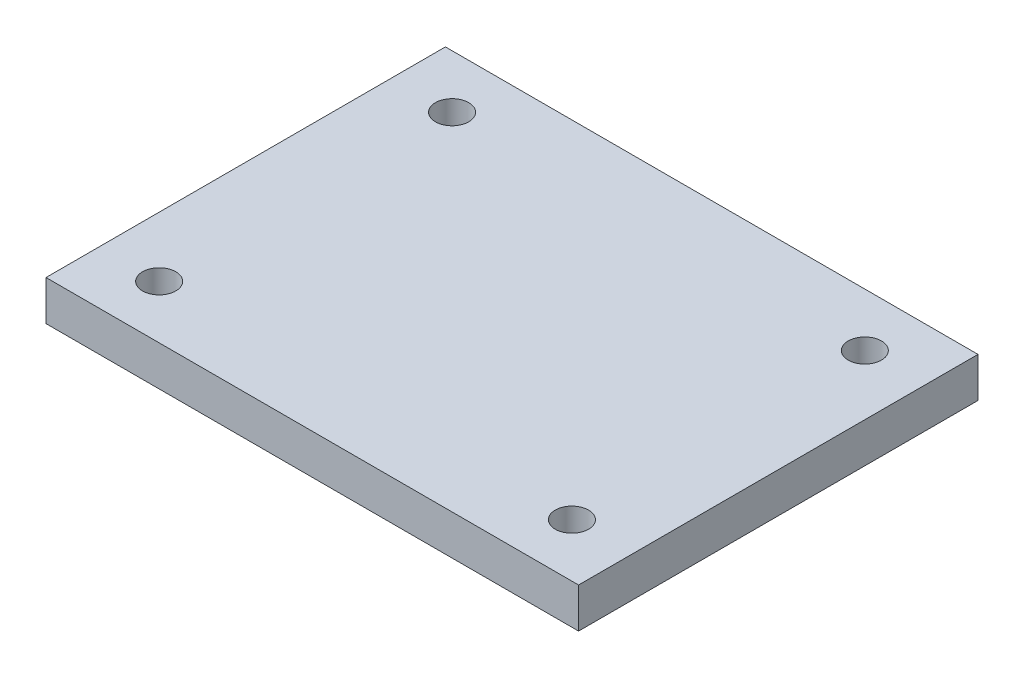
from build123d import *

# Parameters (mm, degrees)
SKETCH_1_W          = 40
SKETCH_1_H          = 30
EXTRUDE_1_DEPTH     = 3
SKETCH_2_R          = 1.25
CUT_EXTRUDE_1_DEPTH = 10


with BuildPart() as part:
    # 草图1 → 凸台-拉伸1 (new body)
    with BuildSketch(Plane(origin=(0, 0, 0), x_dir=(1, 0, 0), z_dir=(0, 1, 0))):
        Rectangle(SKETCH_1_W, SKETCH_1_H)
    extrude(amount=EXTRUDE_1_DEPTH)

    # 草图2 → 切除-拉伸1 (cut)
    with BuildSketch(Plane(origin=(0, 3, 0), x_dir=(1, 0, 0), z_dir=(0, 1, 0))):
        with Locations(Location((15.5, 11, 0), (0, 0, 270))):
            Circle(SKETCH_2_R)
        with Locations(Location((-15.5, 11, 0), (0, 0, 270))):
            Circle(SKETCH_2_R)
        with Locations(Location((-15.5, -11, 0), (0, 0, 270))):
            Circle(SKETCH_2_R)
        with Locations(Location((15.5, -11, 0), (0, 0, 270))):
            Circle(SKETCH_2_R)
    extrude(amount=-CUT_EXTRUDE_1_DEPTH, mode=Mode.SUBTRACT)


solid = part.part
